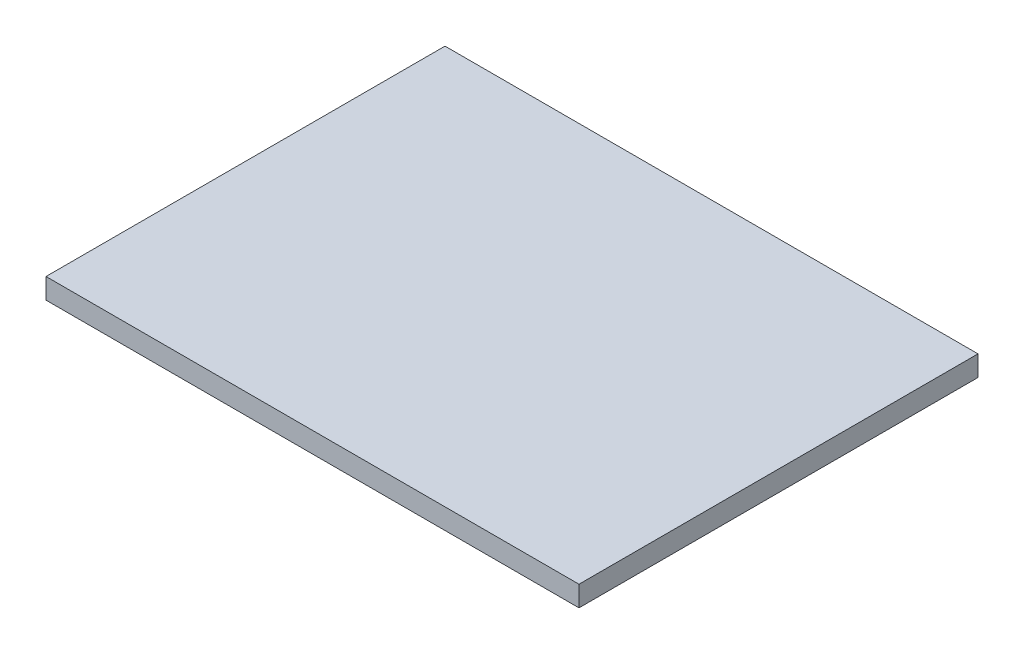
from build123d import *

# Parameters (mm, degrees)
SKETCH1_W           = 260
SKETCH1_H           = 194.63711
BOSS_EXTRUDE1_DEPTH = 10


with BuildPart() as part:
    # Sketch1 → Boss-Extrude1 (new body)
    with BuildSketch(Plane(origin=(0, 0, 0), x_dir=(1, 0, 0), z_dir=(0, 1, 0))):
        Rectangle(SKETCH1_W, SKETCH1_H)
    extrude(amount=BOSS_EXTRUDE1_DEPTH)


solid = part.part
